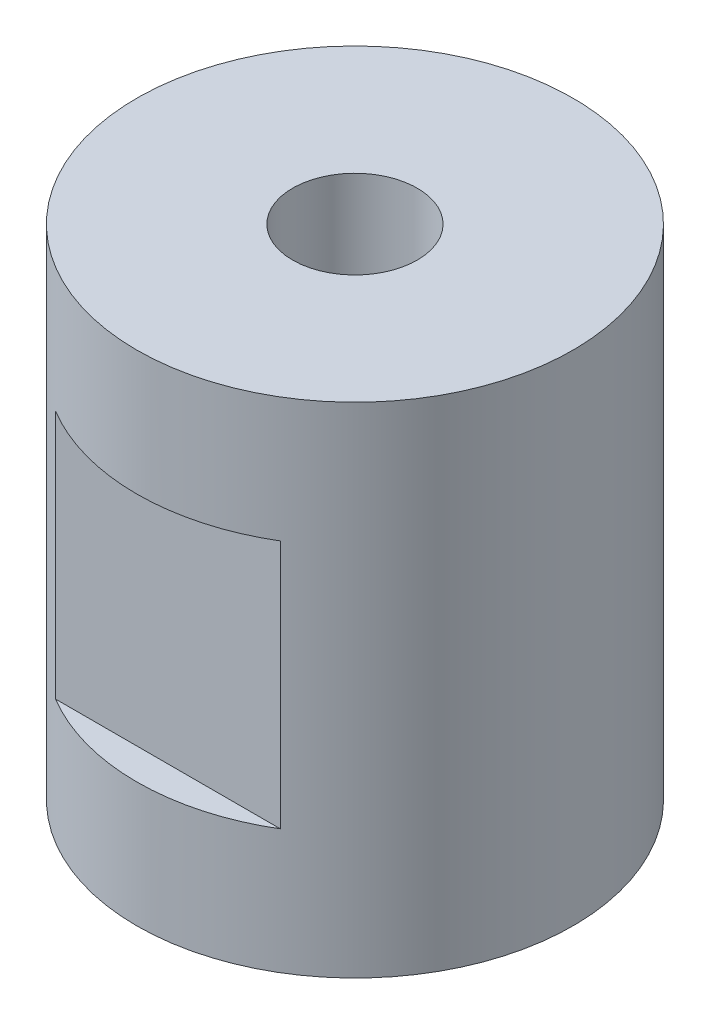
from build123d import *

# Parameters (mm, degrees)
SKETCH1_R               = 35
BOSS_EXTRUDE1_DEPTH     = 40
CUT_EXTRUDE1_DEPTH      = 95.074438611
CUT_EXTRUDE1_DEPTH_BACK = 95.074438611
SKETCH2_R               = 10
SKETCH3_W               = 25.98
SKETCH3_H               = 60
CUT_EXTRUDE2_DEPTH      = 2.5
SKETCH4_W               = 36.06
SKETCH4_H               = 40
CUT_EXTRUDE3_DEPTH      = 5


with BuildPart() as part:
    # Sketch1 → Boss-Extrude1 (new, symmetric)
    with BuildSketch(Plane(origin=(0, 0, 0), x_dir=(1, 0, 0), z_dir=(0, 1, 0))):
        Circle(SKETCH1_R)
    extrude(amount=BOSS_EXTRUDE1_DEPTH, both=True)

    # Sketch2 → Cut-Extrude1 (cut, two sides: drawn at the far end of the back side and taken through both)
    with BuildSketch(Plane(origin=(0, 40, 0), x_dir=(1, 0, 0), z_dir=(0, 1, 0)).offset(-CUT_EXTRUDE1_DEPTH_BACK)):
        Circle(SKETCH2_R)
    extrude(amount=CUT_EXTRUDE1_DEPTH + CUT_EXTRUDE1_DEPTH_BACK, mode=Mode.SUBTRACT)

    # Sketch3 → Cut-Extrude2 (cut)
    with BuildSketch(Plane.ZY.offset(35)):
        Rectangle(SKETCH3_W, SKETCH3_H)
    extrude(amount=-CUT_EXTRUDE2_DEPTH, mode=Mode.SUBTRACT)

    # Sketch4 → Cut-Extrude3 (cut)
    with BuildSketch(Plane.XY.offset(35)):
        Rectangle(SKETCH4_W, SKETCH4_H)
    extrude(amount=-CUT_EXTRUDE3_DEPTH, mode=Mode.SUBTRACT)


solid = part.part
